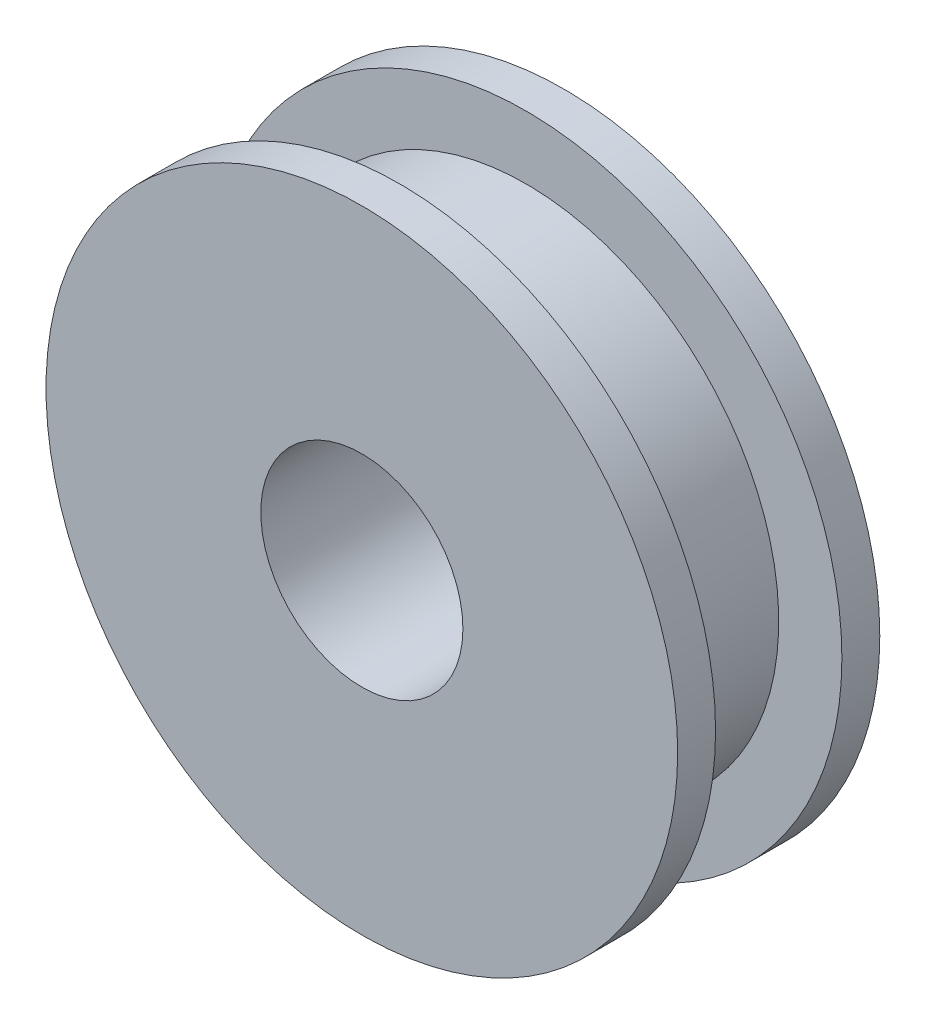
from build123d import *

# Parameters (mm, degrees)
CROQUIS1_R              = 20
CROQUIS1_R_2            = 8
SALIENTE_EXTRUIR1_DEPTH = 5
CROQUIS2_R              = 25
CROQUIS2_R_2            = 8
SALIENTE_EXTRUIR2_DEPTH = 3


with BuildPart() as part:
    # Croquis1 → Saliente-Extruir1 (new, symmetric)
    with BuildSketch(Plane.XY):
        Circle(CROQUIS1_R)
        Circle(CROQUIS1_R_2, mode=Mode.SUBTRACT)
    extrude(amount=SALIENTE_EXTRUIR1_DEPTH, both=True)

    # Croquis2 → Saliente-Extruir2 (add)
    with BuildSketch(Plane.XY.offset(5)):
        Circle(CROQUIS2_R)
        Circle(CROQUIS2_R_2, mode=Mode.SUBTRACT)
    saliente_extruir2 = extrude(amount=SALIENTE_EXTRUIR2_DEPTH)

    # Simetría1: Saliente-Extruir2 across plane
    add(saliente_extruir2.mirror(Plane.XY))


solid = part.part
